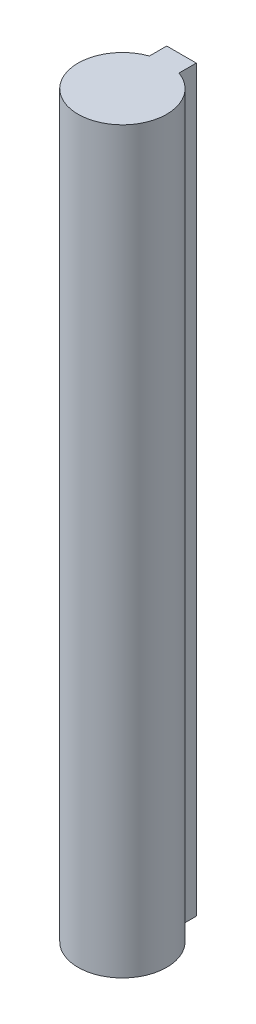
from build123d import *

# Parameters (mm, degrees)
SKETCH_1_R      = 3
EXTRUDE_1_DEPTH = 50
SKETCH_2_W      = 2
SKETCH_2_H      = 2
EXTRUDE_2_DEPTH = 50


with BuildPart() as part:
    # 스케치1 → 보스-돌출1 (new body)
    with BuildSketch(Plane(origin=(0, 0, 0), x_dir=(1, 0, 0), z_dir=(0, 1, 0))):
        with Locations(Location((0, 0, 0), (0, 0, 270))):
            Circle(SKETCH_1_R)
    extrude(amount=EXTRUDE_1_DEPTH)

    # 스케치2 → 보스-돌출2 (add)
    with BuildSketch(Plane(origin=(0, 0, 0), x_dir=(1, 0, 0), z_dir=(0, 1, 0))):
        with Locations((0, 3)):
            Rectangle(SKETCH_2_W, SKETCH_2_H)
    extrude(amount=EXTRUDE_2_DEPTH)


solid = part.part
